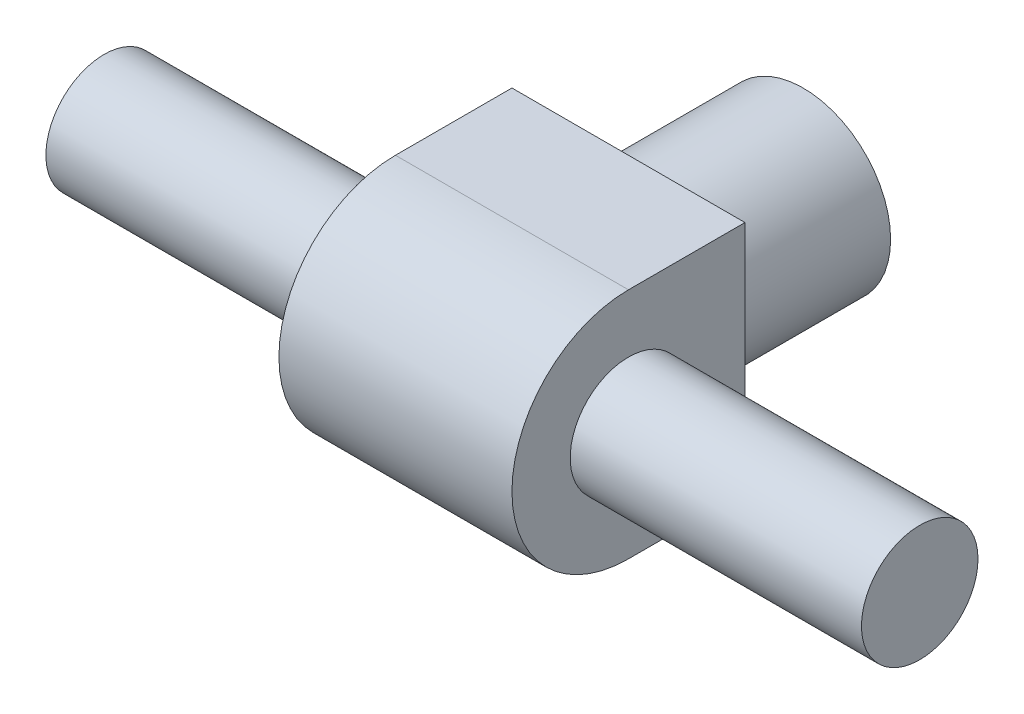
from build123d import *

# Parameters (mm, degrees)
SKETCH_1_R           = 7.5
EXTRUDE_1_DEPTH      = 15
EXTRUDE_2_DEPTH      = 10
EXTRUDE_2_DEPTH_BACK = 10
EXTRUDE_3_DEPTH      = 35
EXTRUDE_3_DEPTH_BACK = 35
SKETCH_3_R           = 5


with BuildPart() as part:
    # Эскиз1 → Бобышка-Вытянуть1 (new body)
    with BuildSketch(Plane.XY):
        Circle(SKETCH_1_R)
    extrude(amount=EXTRUDE_1_DEPTH)

    # Эскиз2 → Бобышка-Вытянуть2 (add, two sides: drawn at the far end of the back side and taken through both)
    with BuildSketch(Plane(origin=(0, 0, 0), x_dir=(0, 0, -1), z_dir=(1, 0, 0)).offset(-EXTRUDE_2_DEPTH_BACK)):
        with BuildLine():
            Line((-15, 10), (-25, 10))
            ThreePointArc((-25, 10), (-35, 0), (-25, -10))
            Line((-25, -10), (-15, -10))
            Line((-15, -10), (-15, 10))
        make_face()
    extrude(amount=EXTRUDE_2_DEPTH + EXTRUDE_2_DEPTH_BACK)

    # Эскиз3 → Бобышка-Вытянуть3 (add, two sides: drawn at the far end of the back side and taken through both)
    with BuildSketch(Plane(origin=(0, 0, 0), x_dir=(0, 0, -1), z_dir=(1, 0, 0)).offset(-EXTRUDE_3_DEPTH_BACK)):
        with Locations((-25, 0)):
            Circle(SKETCH_3_R)
    extrude(amount=EXTRUDE_3_DEPTH + EXTRUDE_3_DEPTH_BACK)


solid = part.part
